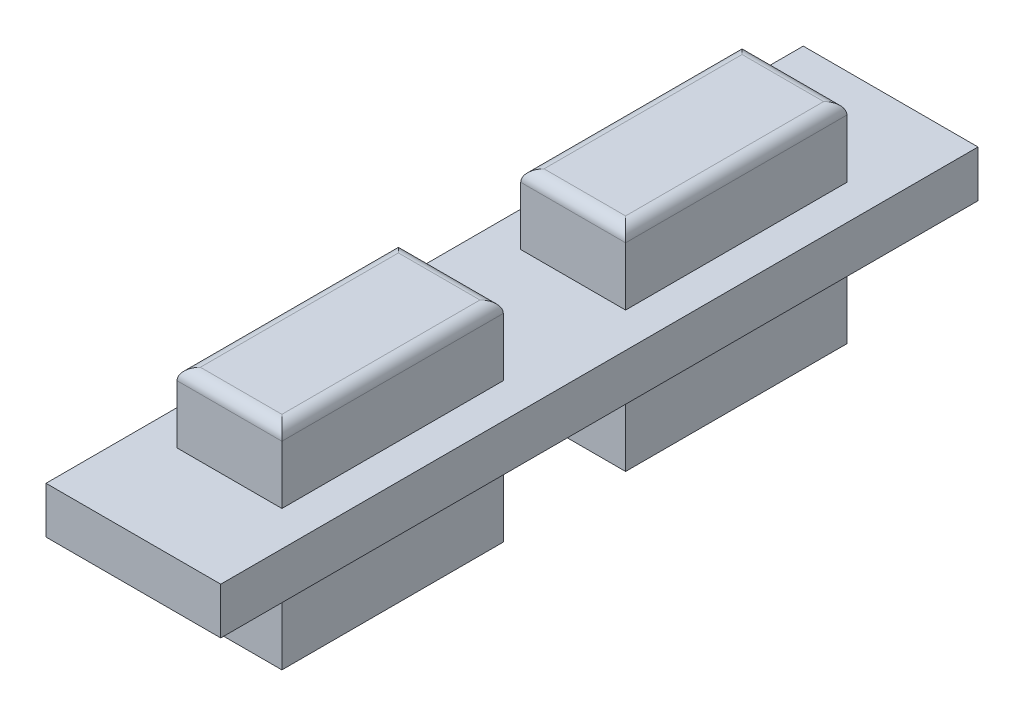
from build123d import *

# Parameters (mm, degrees)
BOSS_EXTRUDE1_DEPTH      = 0.508
BOSS_EXTRUDE1_DEPTH_BACK = 0.508
SKETCH1_W                = 3.81
SKETCH1_H                = 16.51
BOSS_EXTRUDE2_DEPTH      = 2.032
BOSS_EXTRUDE2_DEPTH_BACK = 2.54
SKETCH1_3_W              = 2.286
SKETCH1_3_H              = 4.826
FILLET1_R                = 0.254


with BuildPart() as part:
    # Sketch1 → Boss-Extrude1 (new, two sides: drawn at the far end of the back side and taken through both)
    with BuildSketch(Plane(origin=(0, 3.048, 0), x_dir=(1, 0, 0), z_dir=(0, 1, 0)).offset(-BOSS_EXTRUDE1_DEPTH_BACK)):
        with Locations((-21.437752693, -9.378592753)):
            Rectangle(SKETCH1_W, SKETCH1_H)
    extrude(amount=BOSS_EXTRUDE1_DEPTH + BOSS_EXTRUDE1_DEPTH_BACK)

    # Sketch1<3> → Boss-Extrude2 (add, two sides: drawn at the far end of the back side and taken through both)
    with BuildSketch(Plane(origin=(0, 3.048, 0), x_dir=(1, 0, 0), z_dir=(0, 1, 0)).offset(-BOSS_EXTRUDE2_DEPTH_BACK)):
        with Locations((-21.437752693, -5.632092753)):
            Rectangle(SKETCH1_3_W, SKETCH1_3_H)
        with Locations((-21.437752693, -13.125092753)):
            Rectangle(SKETCH1_3_W, SKETCH1_3_H)
    extrude(amount=BOSS_EXTRUDE2_DEPTH + BOSS_EXTRUDE2_DEPTH_BACK)

    # Fillet1
    fillet1_edges = [part.edges().sort_by_distance(p)[0] for p in [
        (-20.294752693, 5.08, 5.632092753),
        (-21.437752693, 5.08, 8.045092753),
        (-22.580752693, 5.08, 5.632092753),
        (-21.437752693, 5.08, 3.219092753),
        (-20.294752693, 5.08, 13.125092753),
        (-21.437752693, 5.08, 15.538092753),
        (-22.580752693, 5.08, 13.125092753),
        (-21.437752693, 5.08, 10.712092753),
    ]]
    fillet(fillet1_edges, radius=FILLET1_R)


solid = part.part
